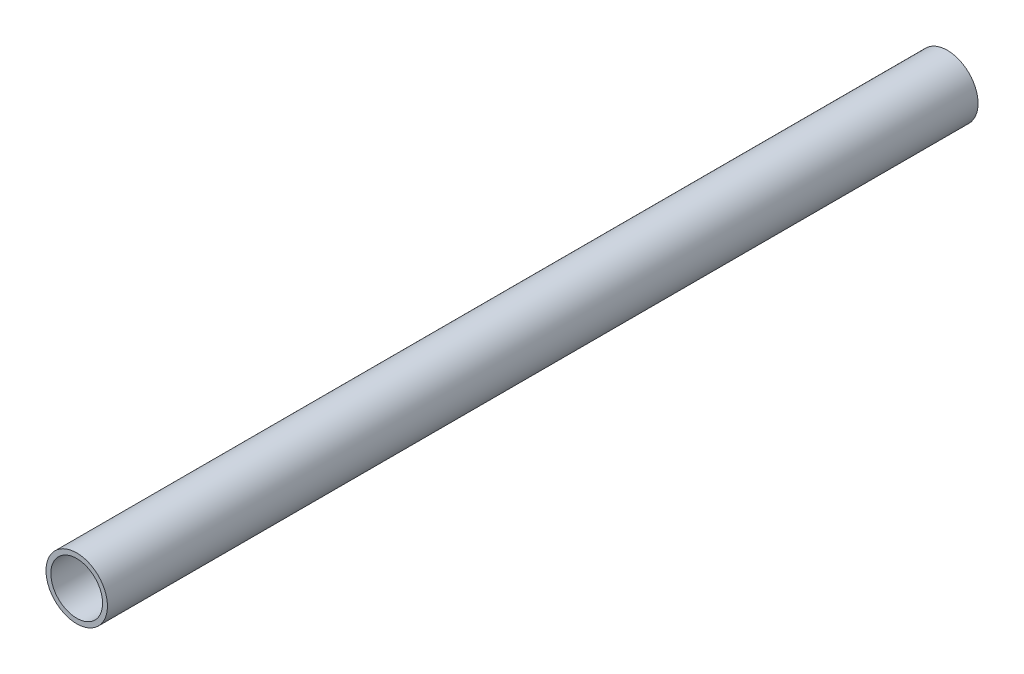
from build123d import *

# Parameters (mm, degrees)
CROQUIS2_R              = 6.35
CROQUIS2_R_2            = 5.35
SALIENTE_EXTRUIR1_DEPTH = 180


with BuildPart() as part:
    # Croquis2 → Saliente-Extruir1 (new body)
    with BuildSketch(Plane.XY):
        with Locations(Location((0, 0, 0), (0, 0, 180))):
            Circle(CROQUIS2_R)
        with Locations(Location((0, 0, 0), (0, 0, 180))):
            Circle(CROQUIS2_R_2, mode=Mode.SUBTRACT)
    extrude(amount=SALIENTE_EXTRUIR1_DEPTH)


solid = part.part
